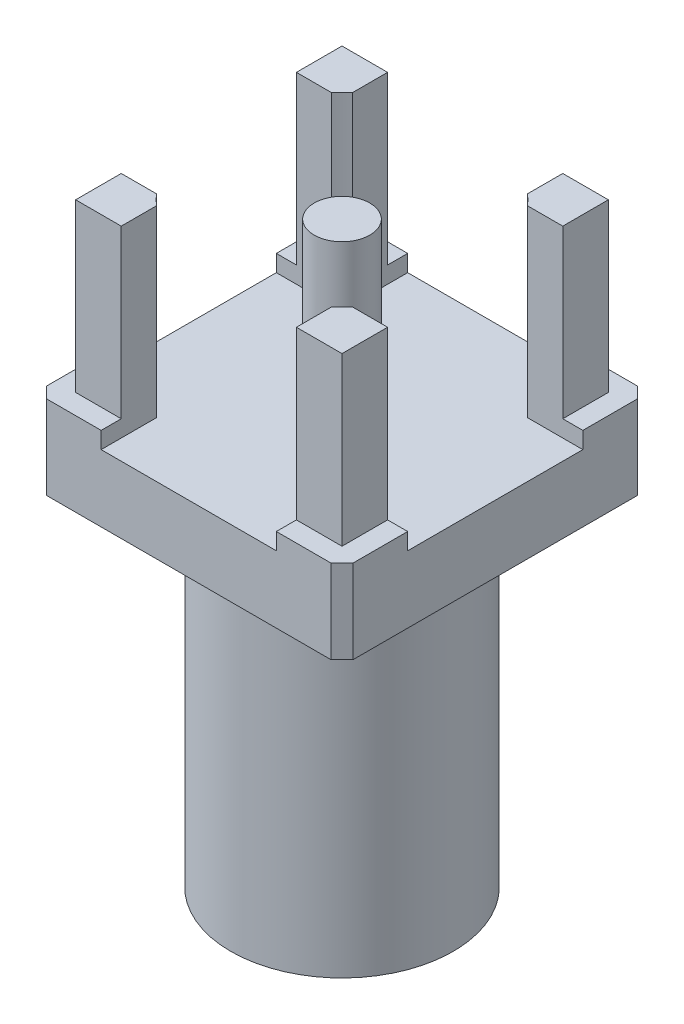
from build123d import *

# Parameters (mm, degrees)
SKETCH1_W           = 7
SKETCH1_H           = 7
BOSS_EXTRUDE1_DEPTH = 1.53
SKETCH2_R           = 2.54
BOSS_EXTRUDE2_DEPTH = 7.874
SKETCH3_R           = 0.635
BOSS_EXTRUDE3_DEPTH = 3.81
CHAMFER1_SIZE       = 0.25
BOSS_EXTRUDE4_DEPTH = 0.381
SKETCH5_W           = 1.0414
SKETCH5_H           = 1.0414
BOSS_EXTRUDE5_DEPTH = 3.81
SKETCH6_R           = 3
SKETCH6_R_2         = 2.55
FILE_TO_FIT_DEPTH   = 4.191


with BuildPart() as part:
    # Sketch1 → Boss-Extrude1 (new body)
    with BuildSketch(Plane(origin=(0, 0, 0), x_dir=(1, 0, 0), z_dir=(0, 1, 0))):
        Rectangle(SKETCH1_W, SKETCH1_H)
    extrude(amount=BOSS_EXTRUDE1_DEPTH)

    # Sketch2 → Boss-Extrude2 (add)
    with BuildSketch(Plane.XZ):
        with Locations(Location((0, 0, 0), (0, 0, 270))):
            Circle(SKETCH2_R)
    extrude(amount=BOSS_EXTRUDE2_DEPTH)

    # Sketch3 → Boss-Extrude3 (add)
    with BuildSketch(Plane(origin=(0, 1.53, 0), x_dir=(1, 0, 0), z_dir=(0, 1, 0))):
        with Locations(Location((0, 0, 0), (0, 0, 90))):
            Circle(SKETCH3_R)
    extrude(amount=BOSS_EXTRUDE3_DEPTH)

    # Chamfer1
    chamfer1_edges = [part.edges().sort_by_distance(p)[0] for p in [
        (3.5, 0.765, 3.5),
        (-3.5, 0.765, 3.5),
        (-3.5, 0.765, -3.5),
        (3.5, 0.765, -3.5),
    ]]
    chamfer(chamfer1_edges, length=CHAMFER1_SIZE)

    # Sketch4 → Boss-Extrude4 (add)
    with BuildSketch(Plane(origin=(0, 1.53, 0), x_dir=(1, 0, 0), z_dir=(0, 1, 0))):
        Polygon((-3.5, 2), (-2, 2), (-2, 3.5), (-3.25, 3.5), (-3.5, 3.25), align=None)
        Polygon((3.5, 3.25), (3.5, 2), (2, 2), (2, 3.5), (3.25, 3.5), align=None)
        Polygon((3.5, -2), (2, -2), (2, -3.5), (3.25, -3.5), (3.5, -3.25), align=None)
        Polygon((-3.5, -3.25), (-3.5, -2), (-2, -2), (-2, -3.5), (-3.25, -3.5), align=None)
    extrude(amount=BOSS_EXTRUDE4_DEPTH)

    # Sketch5 → Boss-Extrude5 (add)
    with BuildSketch(Plane(origin=(0, 1.911, 0), x_dir=(1, 0, 0), z_dir=(0, 1, 0))):
        with Locations((-2.5207, 2.5207)):
            Rectangle(SKETCH5_W, SKETCH5_H)
        with Locations((2.5207, 2.5207)):
            Rectangle(SKETCH5_W, SKETCH5_H)
        with Locations((2.5207, -2.5207)):
            Rectangle(SKETCH5_W, SKETCH5_H)
        with Locations((-2.5207, -2.5207)):
            Rectangle(SKETCH5_W, SKETCH5_H)
    extrude(amount=BOSS_EXTRUDE5_DEPTH)

    # Sketch6 → File To Fit (cut)
    with BuildSketch(Plane(origin=(0, 5.721, 0), x_dir=(1, 0, 0), z_dir=(0, 1, 0))):
        Circle(SKETCH6_R)
        Circle(SKETCH6_R_2, mode=Mode.SUBTRACT)
    extrude(amount=-FILE_TO_FIT_DEPTH, mode=Mode.SUBTRACT)


solid = part.part
